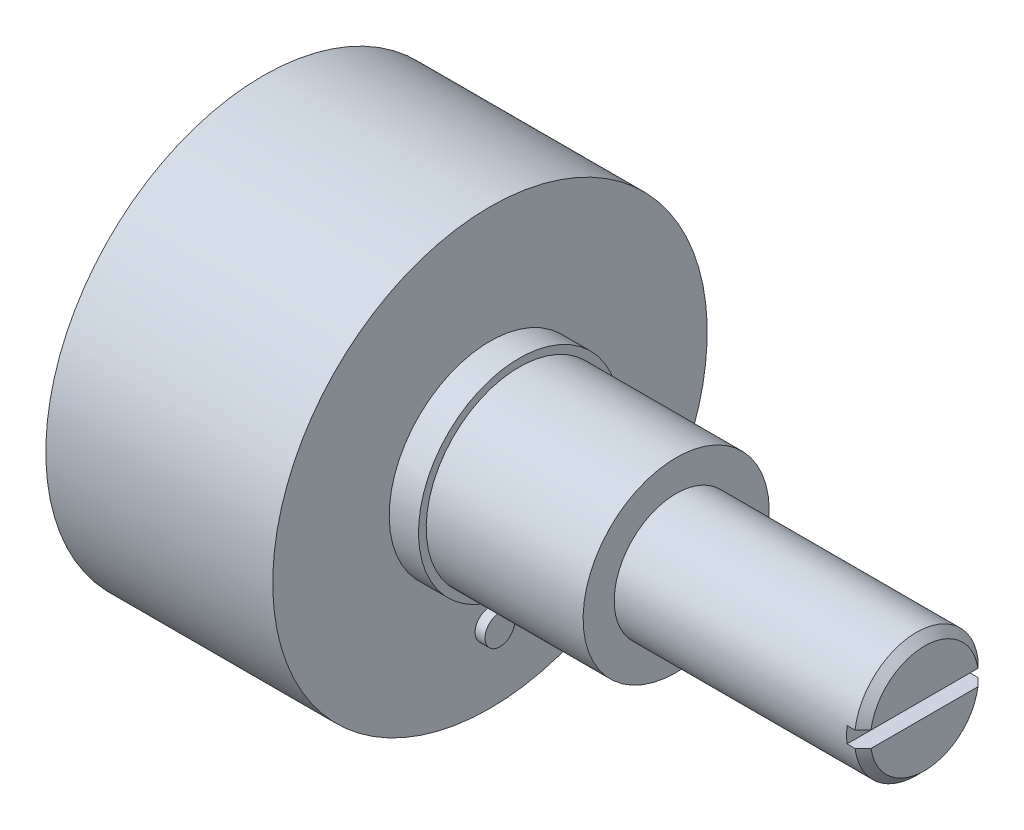
from build123d import *

# Parameters (mm, degrees)
SKETCH3_R               = 0.762
BOSS_EXTRUDE1_DEPTH     = 0.508
CUT_EXTRUDE1_DEPTH      = 28.219954767
CUT_EXTRUDE1_DEPTH_BACK = 28.219954767
SKETCH4_W               = 0.8128
SKETCH4_H               = 0.8128
CHAMFER1_SIZE           = 0.4064


with BuildPart() as part:
    # Sketch2 → Revolve1 (revolve)
    with BuildSketch(Plane.XY):
        Polygon((0, 0), (22.225, 0), (22.225, 3.17119), (9.525, 3.17119), (9.525, 4.7625), (1.4986, 4.7625), (1.4986, 5.1562), (0, 5.1562), (0, 11.1125), (-11.6078, 11.1125), (-11.6078, 0), align=None)
    revolve(axis=Axis((22.225, 0, 0), (1, 0, 0)))

    # Sketch3 → Boss-Extrude1 (add, symmetric)
    with BuildSketch(Plane(origin=(0, 0, 0), x_dir=(0, 0, -1), z_dir=(1, 0, 0))):
        with Locations((0, -7.366)):
            Circle(SKETCH3_R)
    extrude(amount=BOSS_EXTRUDE1_DEPTH, both=True)

    # Sketch4 → Cut-Extrude1 (cut, two sides: drawn at the far end of the back side and taken through both)
    with BuildSketch(Plane.XY.offset(-CUT_EXTRUDE1_DEPTH_BACK)):
        with Locations((21.8186, 0)):
            Rectangle(SKETCH4_W, SKETCH4_H)
    extrude(amount=CUT_EXTRUDE1_DEPTH + CUT_EXTRUDE1_DEPTH_BACK, mode=Mode.SUBTRACT)

    # Chamfer1
    chamfer1_edges = [part.edges().sort_by_distance(p)[0] for p in [
        (22.225, -3.17119, 0),
        (22.225, 2.381723917, 2.093761496),
    ]]
    chamfer(chamfer1_edges, length=CHAMFER1_SIZE)


solid = part.part
